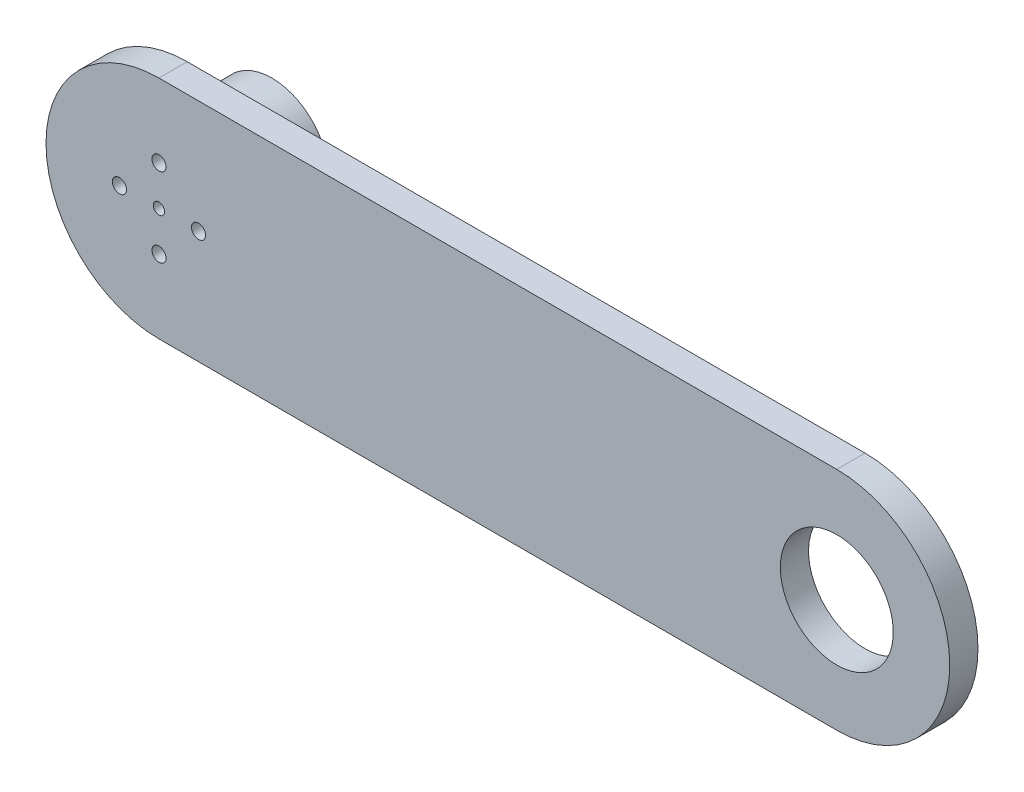
from build123d import *

# Parameters (mm, degrees)
BOSS_EXTRUDE1_DEPTH   = 5
CUT_EXTRUDE1_REACH    = 143.51
SKETCH2_R             = 1
SKETCH2_R_2           = 1.25
CUT_EXTRUDE2_REACH    = 143.51
SKETCH3_R             = 10
BODY_MOVE_COPY1_ANGLE = 90
SKETCH12_R            = 10
BOSS_EXTRUDE2_DEPTH   = 15


with BuildPart() as part:
    # Sketch1 → Boss-Extrude1 (new body)
    with BuildSketch(Plane(origin=(0, 0, 0), x_dir=(1, 0, 0), z_dir=(0, 1, 0))):
        with BuildLine():
            Line((120, -20), (0, -20))
            ThreePointArc((0, -20), (-20, 0), (0, 20))
            Line((0, 20), (120, 20))
            ThreePointArc((120, 20), (140, 0), (120, -20))
        make_face()
    extrude(amount=BOSS_EXTRUDE1_DEPTH)

    # Sketch2 → Cut-Extrude1 (cut, up to next)
    with BuildSketch(Plane(origin=(0, 5, 0), x_dir=(1, 0, 0), z_dir=(0, 1, 0)), mode=Mode.PRIVATE) as cut_extrude1_sk1:
        with Locations(Location((0, 0, 0), (0, 0, 270))):
            Circle(SKETCH2_R)
    cut_extrude1_tool1 = extrude(cut_extrude1_sk1.sketch, amount=-CUT_EXTRUDE1_REACH, mode=Mode.PRIVATE) & part.part
    # Sketch2 → Cut-Extrude1 (cut, up to next)
    with BuildSketch(Plane(origin=(0, 5, 0), x_dir=(1, 0, 0), z_dir=(0, 1, 0)), mode=Mode.PRIVATE) as cut_extrude1_sk2:
        with Locations(Location((0, 7, 0), (0, 0, 270))):
            Circle(SKETCH2_R_2)
    cut_extrude1_tool2 = extrude(cut_extrude1_sk2.sketch, amount=-CUT_EXTRUDE1_REACH, mode=Mode.PRIVATE) & part.part
    # Sketch2 → Cut-Extrude1 (cut, up to next)
    with BuildSketch(Plane(origin=(0, 5, 0), x_dir=(1, 0, 0), z_dir=(0, 1, 0)), mode=Mode.PRIVATE) as cut_extrude1_sk3:
        with Locations(Location((7.001, 0.001, 0), (0, 0, 270))):
            Circle(SKETCH2_R_2)
    cut_extrude1_tool3 = extrude(cut_extrude1_sk3.sketch, amount=-CUT_EXTRUDE1_REACH, mode=Mode.PRIVATE) & part.part
    # Sketch2 → Cut-Extrude1 (cut, up to next)
    with BuildSketch(Plane(origin=(0, 5, 0), x_dir=(1, 0, 0), z_dir=(0, 1, 0)), mode=Mode.PRIVATE) as cut_extrude1_sk4:
        with Locations(Location((0.002, -7, 0), (0, 0, 270))):
            Circle(SKETCH2_R_2)
    cut_extrude1_tool4 = extrude(cut_extrude1_sk4.sketch, amount=-CUT_EXTRUDE1_REACH, mode=Mode.PRIVATE) & part.part
    # Sketch2 → Cut-Extrude1 (cut, up to next)
    with BuildSketch(Plane(origin=(0, 5, 0), x_dir=(1, 0, 0), z_dir=(0, 1, 0)), mode=Mode.PRIVATE) as cut_extrude1_sk5:
        with Locations(Location((-6.999, -0.001, 0), (0, 0, 270))):
            Circle(SKETCH2_R_2)
    cut_extrude1_tool5 = extrude(cut_extrude1_sk5.sketch, amount=-CUT_EXTRUDE1_REACH, mode=Mode.PRIVATE) & part.part
    add(cut_extrude1_tool1.solids().sort_by_distance((0, 5, 0))[0], mode=Mode.SUBTRACT)
    add(cut_extrude1_tool2.solids().sort_by_distance((0, 5, -7))[0], mode=Mode.SUBTRACT)
    add(cut_extrude1_tool3.solids().sort_by_distance((7.001, 5, -0.001))[0], mode=Mode.SUBTRACT)
    add(cut_extrude1_tool4.solids().sort_by_distance((0.002, 5, 7))[0], mode=Mode.SUBTRACT)
    add(cut_extrude1_tool5.solids().sort_by_distance((-6.999, 5, 0.001))[0], mode=Mode.SUBTRACT)

    # Sketch3 → Cut-Extrude2 (cut, up to next)
    with BuildSketch(Plane(origin=(0, 5, 0), x_dir=(1, 0, 0), z_dir=(0, 1, 0)), mode=Mode.PRIVATE) as cut_extrude2_sk1:
        with Locations(Location((120, 0, 0), (0, 0, 270))):
            Circle(SKETCH3_R)
    cut_extrude2_tool1 = extrude(cut_extrude2_sk1.sketch, amount=-CUT_EXTRUDE2_REACH, mode=Mode.PRIVATE) & part.part
    add(cut_extrude2_tool1.solids().sort_by_distance((120, 5, 0))[0], mode=Mode.SUBTRACT)


with BuildPart() as part_1:
    # Body-Move/Copy1: moved
    add(part.part.rotate(Axis((0, 0, 0), (1, 0, 0)), BODY_MOVE_COPY1_ANGLE))

    # Sketch12 → Boss-Extrude2 (add)
    with BuildSketch(Plane(origin=(0, 0, 0), x_dir=(-1, 0, 0), z_dir=(0, 0, -1))):
        with Locations(Location((0, 0, 0), (0, 0, 270))):
            Circle(SKETCH12_R)
    extrude(amount=BOSS_EXTRUDE2_DEPTH)


with BuildPart() as part_2:
    # Body-Move/Copy4: moved
    add(part_1.part.moved(Location((0, 0, -5))))


solid = part_2.part
